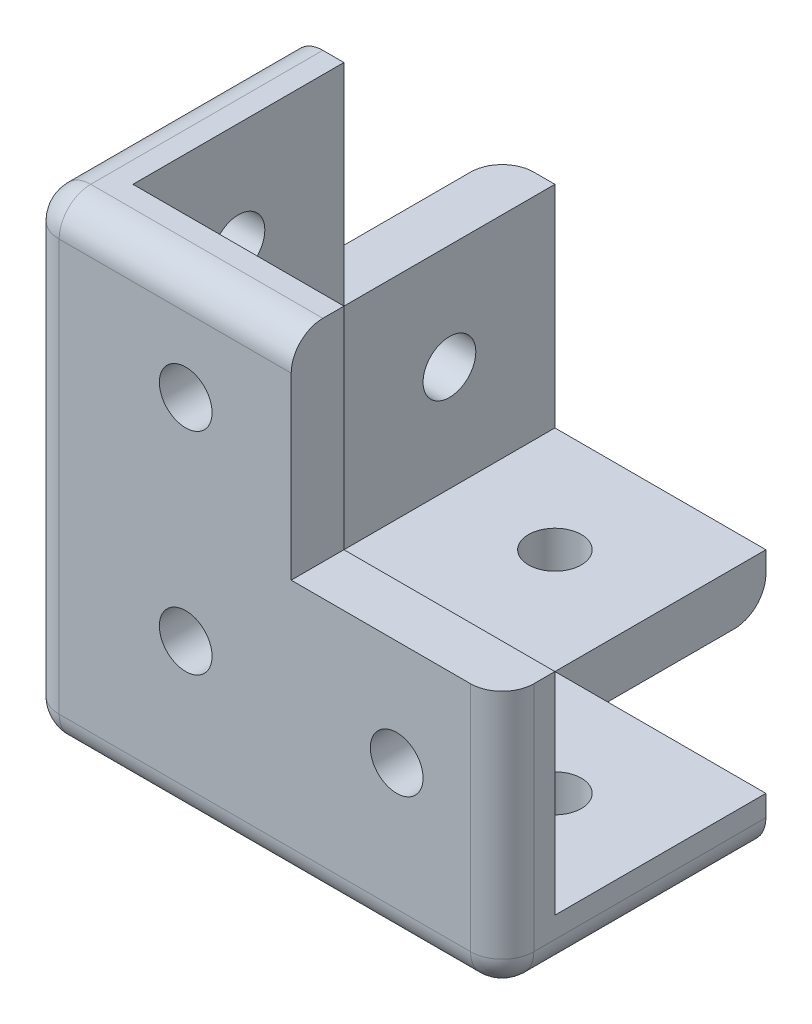
from build123d import *

# Parameters (mm, degrees)
SKETCH_1_W          = 20
SKETCH_1_H          = 20
EXTRUDE_1_DEPTH     = 20
EXTRUDE_1_2_DEPTH   = 20
SKETCH_1_3_W        = 20
SKETCH_1_3_H        = 20
EXTRUDE_2_DEPTH     = 40
EXTRUDE_3_DEPTH     = 5
EXTRUDE_4_DEPTH     = 5
EXTRUDE_5_DEPTH     = 5
CUT_EXTRUDE_1_DEPTH = 40
SKETCH_7_R          = 2.5
CUT_EXTRUDE_2_DEPTH = 5
SKETCH_9_R          = 2.5
CUT_EXTRUDE_3_DEPTH = 5
SKETCH_10_R         = 2.5
CUT_EXTRUDE_4_DEPTH = 5
FILLET_1_R          = 3


with BuildPart() as part:
    # 스케치1 → 보스-돌출1 (new body)
    with BuildSketch(Plane(origin=(0, 0, 0), x_dir=(1, 0, 0), z_dir=(0, 1, 0))):
        with Locations((30, 10)):
            Rectangle(SKETCH_1_W, SKETCH_1_H)
    extrude(amount=EXTRUDE_1_DEPTH)



with BuildPart() as body_2:
    # 스케치1 → Extrude 1 2 (new body)
    with BuildSketch(Plane(origin=(0, 0, 0), x_dir=(1, 0, 0), z_dir=(0, 1, 0))):
        with Locations((10, 30)):
            Rectangle(SKETCH_1_W, SKETCH_1_H)
    extrude(amount=EXTRUDE_1_2_DEPTH)


with BuildPart() as part_1:
    add(part.part)

    add(body_2.part)  # 보스-돌출2 merges body 2
    # 스케치1<3> → 보스-돌출2 (add)
    with BuildSketch(Plane(origin=(0, 0, 0), x_dir=(1, 0, 0), z_dir=(0, 1, 0))):
        with Locations((10, 10)):
            Rectangle(SKETCH_1_3_W, SKETCH_1_3_H)
    extrude(amount=EXTRUDE_2_DEPTH)



with BuildPart() as body_2_2:
    # 스케치2 → 보스-돌출3 (new body)
    with BuildSketch(Plane.XY):
        Polygon((0, 0), (40, 0), (40, 20), (20, 20), (20, 40), (0, 40), align=None)
    extrude(amount=EXTRUDE_3_DEPTH)


with BuildPart() as body_3:
    # 스케치3 → 보스-돌출4 (new body)
    with BuildSketch(Plane.ZY):
        Polygon((5, 40), (-20, 40), (-20, 20), (-40, 20), (-40, 0), (5, 0), align=None)
    extrude(amount=EXTRUDE_4_DEPTH)


with BuildPart() as part_2:
    add(part_1.part)

    add(body_2_2.part)  # 보스-돌출5 merges body 2 2

    add(body_3.part)  # 보스-돌출5 merges body 3
    # 스케치5 → 보스-돌출5 (add)
    with BuildSketch(Plane.XZ):
        Polygon((40, 5), (-5, 5), (-5, -40), (20, -40), (20, -20), (40, -20), align=None)
    extrude(amount=EXTRUDE_5_DEPTH)

    # 스케치6 → 컷-돌출1 (cut)
    with BuildSketch(Plane(origin=(0, 40, 0), x_dir=(1, 0, 0), z_dir=(0, 1, 0))):
        Polygon((0, 0), (40, 0), (40, 20), (20, 20), (20, 40), (0, 40), align=None)
    extrude(amount=-CUT_EXTRUDE_1_DEPTH, mode=Mode.SUBTRACT)

    # 스케치7 → 컷-돌출2 (cut)
    with BuildSketch(Plane(origin=(0, 0, 0), x_dir=(1, 0, 0), z_dir=(0, 1, 0))):
        with Locations((10, 30)):
            Circle(SKETCH_7_R)
        with Locations((30, 10)):
            Circle(SKETCH_7_R)
        with Locations((10, 10)):
            Circle(SKETCH_7_R)
    extrude(amount=-CUT_EXTRUDE_2_DEPTH, mode=Mode.SUBTRACT)

    # 스케치9 → 컷-돌출3 (cut)
    with BuildSketch(Plane(origin=(0, 0, 0), x_dir=(-1, 0, 0), z_dir=(0, 0, -1))):
        with Locations((-10, 30)):
            Circle(SKETCH_9_R)
        with Locations((-30, 10)):
            Circle(SKETCH_9_R)
        with Locations((-10, 10)):
            Circle(SKETCH_9_R)
    extrude(amount=-CUT_EXTRUDE_3_DEPTH, mode=Mode.SUBTRACT)

    # 스케치10 → 컷-돌출4 (cut)
    with BuildSketch(Plane(origin=(0, 0, 0), x_dir=(0, 0, -1), z_dir=(1, 0, 0))):
        with Locations((10, 30)):
            Circle(SKETCH_10_R)
        with Locations((30, 10)):
            Circle(SKETCH_10_R)
        with Locations((10, 10)):
            Circle(SKETCH_10_R)
    extrude(amount=-CUT_EXTRUDE_4_DEPTH, mode=Mode.SUBTRACT)

    # 필렛1
    fillet_1_edges = [part_2.edges().sort_by_distance(p)[0] for p in [
        (-5, 7.5, -40),
        (7.5, -5, -40),
        (40, -5, -7.5),
        (40, 7.5, 5),
        (17.5, -5, 5),
        (-5, -5, -17.5),
        (-5, 17.5, 5),
        (-5, 40, -7.5),
        (7.5, 40, 5),
    ]]
    fillet(fillet_1_edges, radius=FILLET_1_R)


solid = part_2.part
